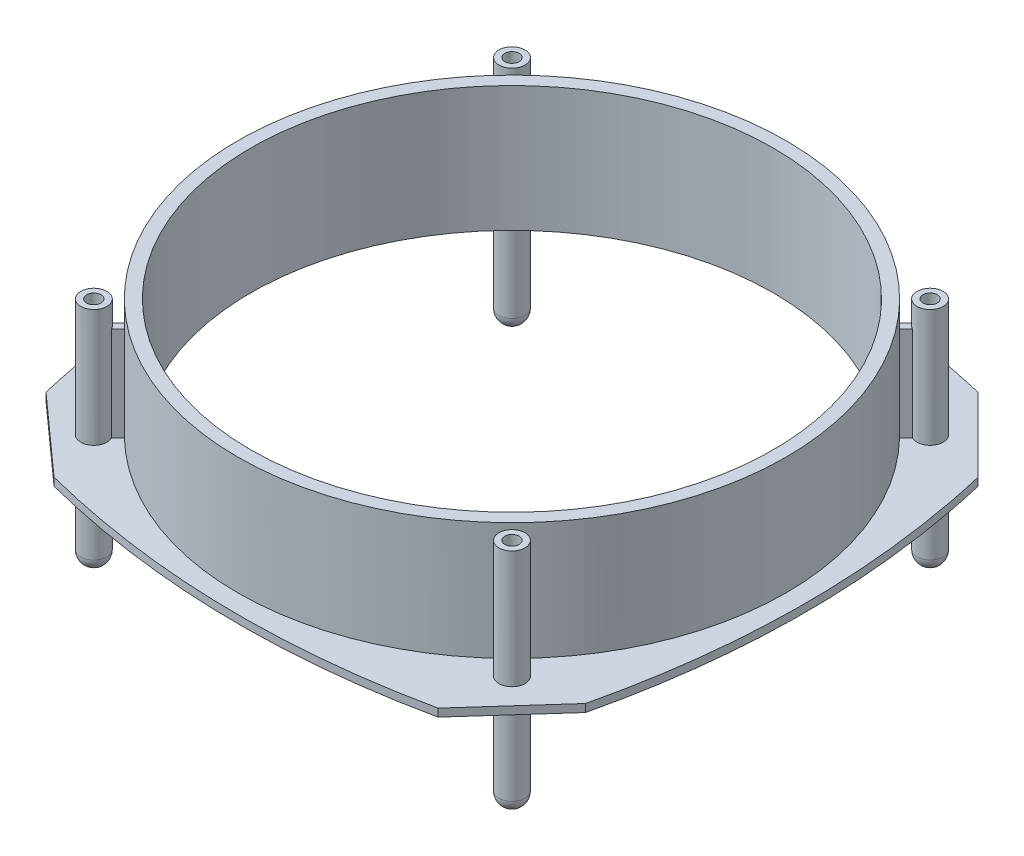
from build123d import *

# Parameters (mm, degrees)
SKETCH2_R                = 5000
BOSS_EXTRUDE2_DEPTH      = 150
SKETCH3_R                = 5244.246539356
BOSS_EXTRUDE3_DEPTH      = 2400
SKETCH4_R                = 5000
CUT_EXTRUDE1_DEPTH       = 3000
SKETCH7_R                = 250
BOSS_EXTRUDE12_DEPTH     = 2400
BOSS_EXTRUDE13_START     = 2000
SKETCH9_R                = 250
BOSS_EXTRUDE13_DEPTH     = 2000
FILLET1_R                = 250
SKETCH10_R               = 137.445591435
CUT_EXTRUDE2_DEPTH       = 500
EXTRUDE_THIN10_DEPTH     = 1800
CIRPATTERN1_COUNT        = 4
FILLET1_OF_CIRPATTERN1_R = 250
SCALE2_SCALE             = 0.0315


with BuildPart() as part:
    # Sketch2 → Boss-Extrude2 (new body)
    with BuildSketch(Plane(origin=(0, 0, 0), x_dir=(1, 0, 0), z_dir=(0, 1, 0))):
        with BuildLine():
            Line((3824.429393628, -5236.727592336), (5157.692676049, -3749.624245316))
            add(Edge.make_bspline(
                [(5163.968520998, 3752.344435712), (6040.866701019, 0.596942764), (5157.692676049, -3749.624245316)],
                knots=[0, 0, 0, 1, 1, 1], degree=2))
            Line((5163.968520998, 3752.344435712), (3751.208948661, 5164.143902966))
            add(Edge.make_bspline(
                [(-3751.770188441, 5163.582833105), (-0.337562444, 6037.385508755), (3751.208948661, 5164.143902966)],
                knots=[0, 0, 0, 1, 1, 1], degree=2))
            Line((-3751.770188441, 5163.582833105), (-5163.707873982, 3750.961398637))
            add(Edge.make_bspline(
                [(-5163.707873982, 3750.961398637), (-6037.549572471, -0.53895869), (-5163.076160475, -3751.919756157)],
                knots=[0, 0, 0, 1, 1, 1], degree=2))
            Line((-5163.076160475, -3751.919756157), (-3675.972813455, -5085.183038578))
            add(Edge.make_bspline(
                [(-3675.972813455, -5085.183038578), (54.671333271, -6041.022726245), (3824.429393628, -5236.727592336)],
                knots=[0, 0, 0, 1, 1, 1], degree=2))
        make_face()
        Circle(SKETCH2_R, mode=Mode.SUBTRACT)
    extrude(amount=BOSS_EXTRUDE2_DEPTH)

    # Sketch3 → Boss-Extrude3 (add)
    with BuildSketch(Plane(origin=(0, 0, 0), x_dir=(1, 0, 0), z_dir=(0, 1, 0))):
        Circle(SKETCH3_R)
    extrude(amount=BOSS_EXTRUDE3_DEPTH)

    # Sketch4 → Cut-Extrude1 (cut)
    with BuildSketch(Plane(origin=(0, 2400, 0), x_dir=(1, 0, 0), z_dir=(0, 1, 0))):
        Circle(SKETCH4_R)
    extrude(amount=-CUT_EXTRUDE1_DEPTH, mode=Mode.SUBTRACT)

    # Sketch7 → Boss-Extrude12 (add)
    with BuildSketch(Plane(origin=(0, 0, 0), x_dir=(-1, 0, 0), z_dir=(0, -1, 0))):
        with Locations((4000, 4000)):
            Circle(SKETCH7_R)
    boss_extrude12 = extrude(amount=-BOSS_EXTRUDE12_DEPTH)

    # Sketch9 → Boss-Extrude13 (add)
    with BuildSketch(Plane(origin=(0, 0, 0), x_dir=(-1, 0, 0), z_dir=(0, -1, 0)).offset(BOSS_EXTRUDE13_START)):
        with Locations((4000, 4000)):
            Circle(SKETCH9_R)
    boss_extrude13 = extrude(amount=-BOSS_EXTRUDE13_DEPTH)

    # Fillet1
    fillet1_edges = [part.edges().sort_by_distance(p)[0] for p in [
        (-3750, 0, -4000),
        (-3750, -2000, -4000),
    ]]
    fillet(fillet1_edges, radius=FILLET1_R)

    # Sketch10 → Cut-Extrude2 (cut)
    with BuildSketch(Plane(origin=(0, 2400, 0), x_dir=(1, 0, 0), z_dir=(0, 1, 0))):
        with Locations((-4000, 4000)):
            Circle(SKETCH10_R)
    cut_extrude2 = extrude(amount=-CUT_EXTRUDE2_DEPTH, mode=Mode.SUBTRACT)

    # Sketch13 → Extrude-Thin10 (add)
    with BuildSketch(Plane(origin=(0, 150, 0), x_dir=(1, 0, 0), z_dir=(0, 1, 0))):
        Polygon((-3779.801572758, 3881.624949249), (-3656.98109375, 3758.804470241), (-3707.892781996, 3707.892781996), (-3830.713261004, 3830.713261004), align=None)
        Polygon((-3758.804470241, 3656.98109375), (-3881.624949249, 3779.801572758), (-3830.713261004, 3830.713261004), (-3707.892781996, 3707.892781996), align=None)
    extrude_thin10 = extrude(amount=EXTRUDE_THIN10_DEPTH)

    # CirPattern1: Boss-Extrude12, Boss-Extrude13, Cut-Extrude2, Extrude-Thin10 ×4 about axis
    cirpattern1_axis = Axis((0, 3250, 0), (0, -1, 0))
    add([boss_extrude12.rotate(cirpattern1_axis, i * 360 / CIRPATTERN1_COUNT) for i in range(1, CIRPATTERN1_COUNT)])
    add([boss_extrude13.rotate(cirpattern1_axis, i * 360 / CIRPATTERN1_COUNT) for i in range(1, CIRPATTERN1_COUNT)])
    add([cut_extrude2.rotate(cirpattern1_axis, i * 360 / CIRPATTERN1_COUNT) for i in range(1, CIRPATTERN1_COUNT)], mode=Mode.SUBTRACT)
    add([extrude_thin10.rotate(cirpattern1_axis, i * 360 / CIRPATTERN1_COUNT) for i in range(1, CIRPATTERN1_COUNT)])

    # Fillet1 of CirPattern1
    fillet1_of_cirpattern1_edges = [part.edges().sort_by_distance(p)[0] for p in [
        (4000, 0, -3750),
        (4000, -2000, -3750),
        (3750, 0, 4000),
        (3750, -2000, 4000),
        (-4000, 0, 3750),
        (-4000, -2000, 3750),
    ]]
    fillet(fillet1_of_cirpattern1_edges, radius=FILLET1_OF_CIRPATTERN1_R)


with BuildPart() as part_1:
    # Scale2: scaled about (9.875442707, 908.130987309, -0.761711413)
    add(part.part.scale(SCALE2_SCALE).moved(Location((9.564366262, 879.524861209, -0.737717503))))


solid = part_1.part
